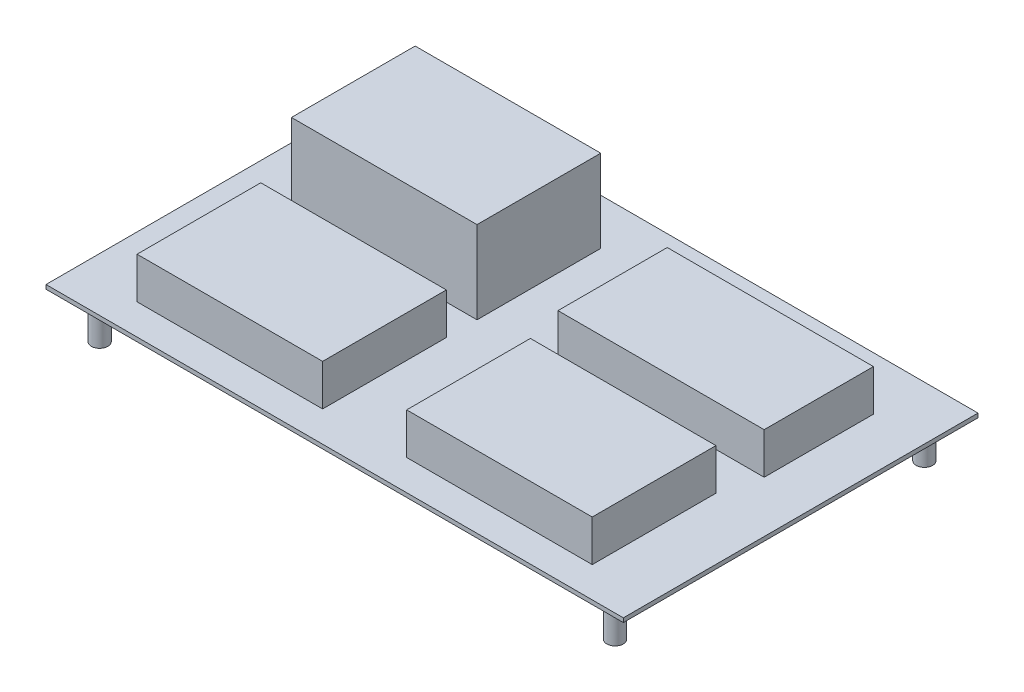
from build123d import *

# Parameters (mm, degrees)
SKETCH_1_W      = 280
SKETCH_1_H      = 172
EXTRUDE_1_DEPTH = 2
SKETCH_2_W      = 90
SKETCH_2_H      = 60
SKETCH_2_W_2    = 100
SKETCH_2_H_2    = 53
EXTRUDE_2_DEPTH = 20
SKETCH_3_W      = 90
SKETCH_3_H      = 60
EXTRUDE_3_DEPTH = 20
SKETCH_4_R      = 4
EXTRUDE_4_DEPTH = 20


with BuildPart() as part:
    # Эскиз1 → Бобышка-Вытянуть1 (new body)
    with BuildSketch(Plane(origin=(0, 0, 0), x_dir=(1, 0, 0), z_dir=(0, 1, 0))):
        Rectangle(SKETCH_1_W, SKETCH_1_H)
    extrude(amount=EXTRUDE_1_DEPTH)

    # Эскиз2 → Бобышка-Вытянуть2 (add)
    with BuildSketch(Plane(origin=(0, 2, 0), x_dir=(1, 0, 0), z_dir=(0, 1, 0))):
        with Locations((-65.639881966, 33.675557069)):
            Rectangle(SKETCH_2_W, SKETCH_2_H)
        with Locations((-65.639881966, -41.201831045)):
            Rectangle(SKETCH_2_W, SKETCH_2_H)
        with Locations((65.116180532, -41.201831045)):
            Rectangle(SKETCH_2_W, SKETCH_2_H)
        with Locations((65.116180532, 33.675557069)):
            Rectangle(SKETCH_2_W_2, SKETCH_2_H_2)
    extrude(amount=EXTRUDE_2_DEPTH)

    # Эскиз3 → Бобышка-Вытянуть3 (add)
    with BuildSketch(Plane(origin=(0, 22, 0), x_dir=(1, 0, 0), z_dir=(0, 1, 0))):
        with Locations((-65.639881966, 33.675557069)):
            Rectangle(SKETCH_3_W, SKETCH_3_H)
    extrude(amount=EXTRUDE_3_DEPTH)

    # Эскиз4 → Бобышка-Вытянуть4 (add)
    with BuildSketch(Plane.XZ):
        with Locations(Location((-125, 75, 0), (0, 0, 270))):
            Circle(SKETCH_4_R)
        with Locations(Location((125, 75, 0), (0, 0, 270))):
            Circle(SKETCH_4_R)
        with Locations(Location((125, -75, 0), (0, 0, 270))):
            Circle(SKETCH_4_R)
        with Locations(Location((-125, -75, 0), (0, 0, 270))):
            Circle(SKETCH_4_R)
    extrude(amount=EXTRUDE_4_DEPTH)


solid = part.part
